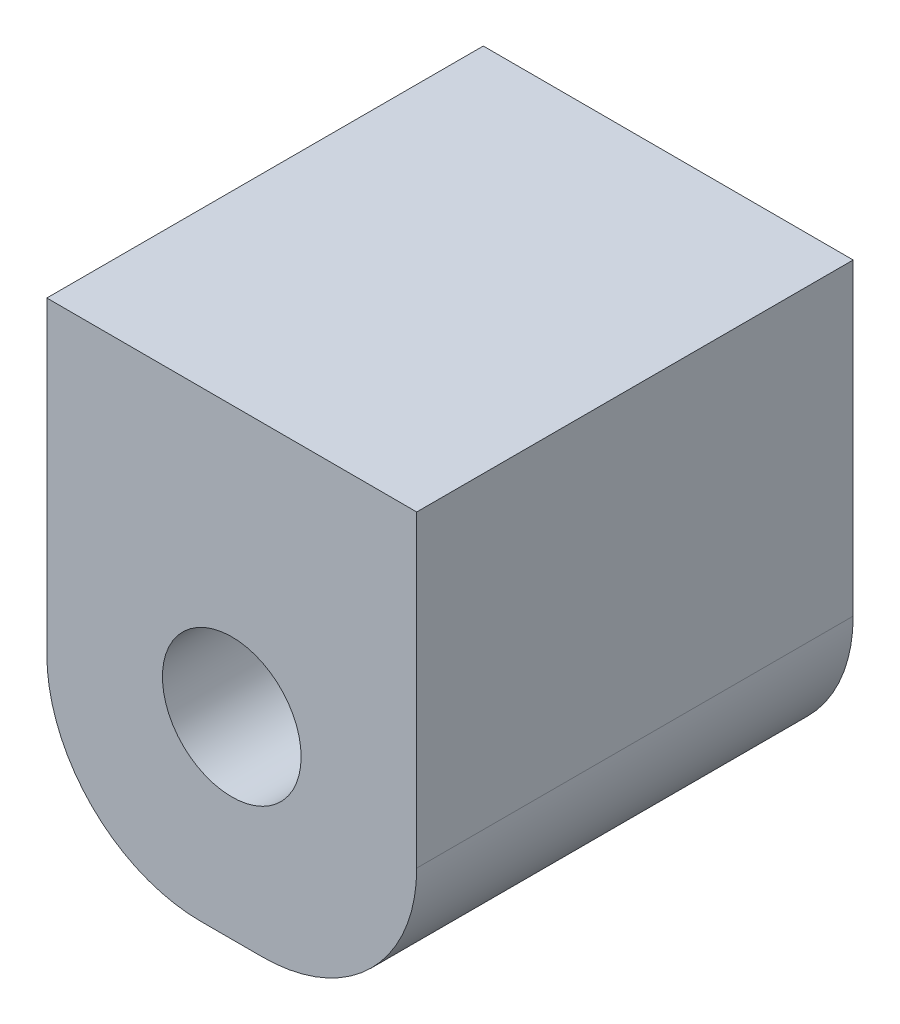
from build123d import *

# Parameters (mm, degrees)
CROQUIS1_R              = 4.5
SALIENTE_EXTRUIR1_DEPTH = 28.32
REDONDEO1_R             = 10


with BuildPart() as part:
    # Croquis1 → Saliente-Extruir1 (new body)
    with BuildSketch(Plane.XY):
        Polygon((14.527798388, -0.008569378), (38.527798388, -0.032811814), (38.527798388, -5.044933007), (38.527798388, -30.044933007), (14.527798388, -30.044933007), (14.527798388, -5.044933007), align=None)
        with Locations((26.527798388, -17.544933007)):
            Circle(CROQUIS1_R, mode=Mode.SUBTRACT)
    extrude(amount=SALIENTE_EXTRUIR1_DEPTH)

    # Redondeo1
    redondeo1_edges = [part.edges().sort_by_distance(p)[0] for p in [
        (14.527798388, -30.044933007, 14.16),
        (38.527798388, -30.044933007, 14.16),
    ]]
    fillet(redondeo1_edges, radius=REDONDEO1_R)


solid = part.part
